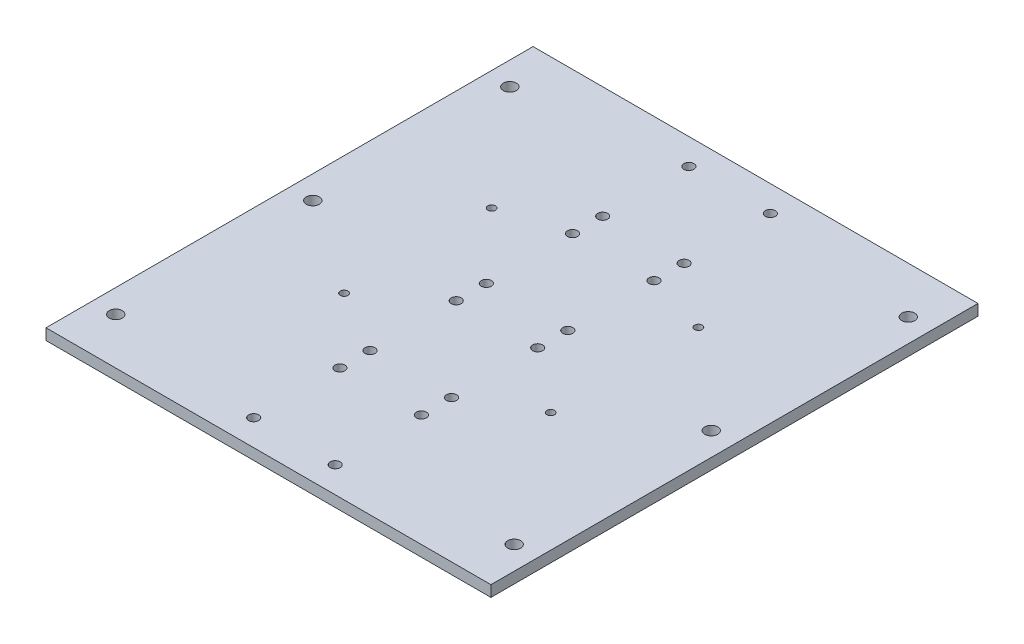
from build123d import *

# Parameters (mm, degrees)
SKETCH1_W           = 191.4
SKETCH1_H           = 209.525
SKETCH1_R           = 2.8
SKETCH1_R_2         = 1.65
SKETCH1_R_3         = 2.159
BOSS_EXTRUDE1_DEPTH = 4.7625


with BuildPart() as part:
    # Sketch1 → Boss-Extrude1 (new body)
    with BuildSketch(Plane(origin=(0, 0, 0), x_dir=(1, 0, 0), z_dir=(0, 1, 0))):
        with Locations((24.187575139, 23.559595031)):
            Rectangle(SKETCH1_W, SKETCH1_H)
        with Locations(Location((-61.512424861, 108.322095031, 0), (0, 0, 90))):
            Circle(SKETCH1_R, mode=Mode.SUBTRACT)
        with Locations(Location((-61.512424861, 23.572095031, 0), (0, 0, 90))):
            Circle(SKETCH1_R, mode=Mode.SUBTRACT)
        with Locations(Location((-61.512424861, -61.202904969, 0), (0, 0, 90))):
            Circle(SKETCH1_R, mode=Mode.SUBTRACT)
        with Locations(Location((109.887575139, -61.202904969, 0), (0, 0, 90))):
            Circle(SKETCH1_R, mode=Mode.SUBTRACT)
        with Locations(Location((109.887575139, 23.572095031, 0), (0, 0, 90))):
            Circle(SKETCH1_R, mode=Mode.SUBTRACT)
        with Locations(Location((109.887575139, 108.322095031, 0), (0, 0, 90))):
            Circle(SKETCH1_R, mode=Mode.SUBTRACT)
        with Locations(Location((-20.262424861, 59.272095031, 0), (0, 0, 90))):
            Circle(SKETCH1_R_2, mode=Mode.SUBTRACT)
        with Locations(Location((68.637575139, 59.272095031, 0), (0, 0, 90))):
            Circle(SKETCH1_R_2, mode=Mode.SUBTRACT)
        with Locations(Location((-20.262424861, -4.227904969, 0), (0, 0, 90))):
            Circle(SKETCH1_R_2, mode=Mode.SUBTRACT)
        with Locations(Location((68.637575139, -4.227904969, 0), (0, 0, 90))):
            Circle(SKETCH1_R_2, mode=Mode.SUBTRACT)
        with Locations(Location((6.661575139, -32.955404969, 0), (0, 0, 90))):
            Circle(SKETCH1_R_3, mode=Mode.SUBTRACT)
        with Locations(Location((41.713575139, -32.955404969, 0), (0, 0, 90))):
            Circle(SKETCH1_R_3, mode=Mode.SUBTRACT)
        with Locations(Location((6.661575139, -70.039404969, 0), (0, 0, 90))):
            Circle(SKETCH1_R_3, mode=Mode.SUBTRACT)
        with Locations(Location((41.713575139, -70.039404969, 0), (0, 0, 90))):
            Circle(SKETCH1_R_3, mode=Mode.SUBTRACT)
        with Locations(Location((6.661575139, 17.082595031, 0), (0, 0, 90))):
            Circle(SKETCH1_R_3, mode=Mode.SUBTRACT)
        with Locations(Location((41.713575139, 17.082595031, 0), (0, 0, 90))):
            Circle(SKETCH1_R_3, mode=Mode.SUBTRACT)
        with Locations(Location((6.661575139, -20.001404969, 0), (0, 0, 90))):
            Circle(SKETCH1_R_3, mode=Mode.SUBTRACT)
        with Locations(Location((41.713575139, -20.001404969, 0), (0, 0, 90))):
            Circle(SKETCH1_R_3, mode=Mode.SUBTRACT)
        with Locations(Location((6.661575139, 67.120595031, 0), (0, 0, 90))):
            Circle(SKETCH1_R_3, mode=Mode.SUBTRACT)
        with Locations(Location((41.713575139, 67.120595031, 0), (0, 0, 90))):
            Circle(SKETCH1_R_3, mode=Mode.SUBTRACT)
        with Locations(Location((6.661575139, 30.036595031, 0), (0, 0, 90))):
            Circle(SKETCH1_R_3, mode=Mode.SUBTRACT)
        with Locations(Location((41.713575139, 30.036595031, 0), (0, 0, 90))):
            Circle(SKETCH1_R_3, mode=Mode.SUBTRACT)
        with Locations(Location((6.661575139, 117.158595031, 0), (0, 0, 90))):
            Circle(SKETCH1_R_3, mode=Mode.SUBTRACT)
        with Locations(Location((41.713575139, 117.158595031, 0), (0, 0, 90))):
            Circle(SKETCH1_R_3, mode=Mode.SUBTRACT)
        with Locations(Location((6.661575139, 80.074595031, 0), (0, 0, 90))):
            Circle(SKETCH1_R_3, mode=Mode.SUBTRACT)
        with Locations(Location((41.713575139, 80.074595031, 0), (0, 0, 90))):
            Circle(SKETCH1_R_3, mode=Mode.SUBTRACT)
    extrude(amount=BOSS_EXTRUDE1_DEPTH)


solid = part.part
